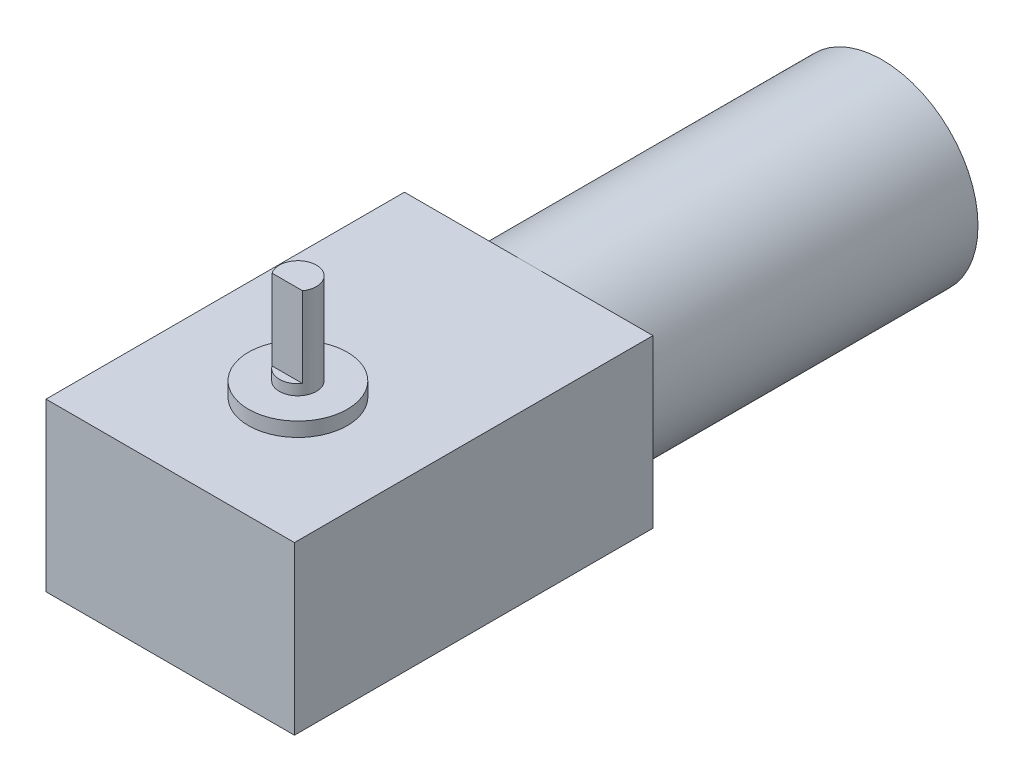
from build123d import *

# Parameters (mm, degrees)
SZKIC1_R                    = 15.5
DODANIE_WYCI_GNI_CIE1_DEPTH = 57.2
SZKIC2_W                    = 40.2
SZKIC2_H                    = 27
DODANIE_WYCI_GNI_CIE2_DEPTH = 58
SZKIC3_R                    = 8
DODANIE_WYCI_GNI_CIE3_DEPTH = 2.3
SZKIC4_R                    = 3
DODANIE_WYCI_GNI_CIE4_DEPTH = 14.7
SZKIC5_W                    = 6.794003974
SZKIC5_H                    = 1.284090098
WYTNIJ_WYCI_GNI_CIE1_DEPTH  = 13
SZKIC6_R                    = 2
WYTNIJ_WYCI_GNI_CIE2_DEPTH  = 7
SZKIC7_R                    = 9.25
DODANIE_WYCI_GNI_CIE5_DEPTH = 4.5
DODANIE_WYCI_GNI_CIE6_START = 2
SZKIC8_R                    = 3.5
SZKIC8_R_2                  = 2
DODANIE_WYCI_GNI_CIE6_DEPTH = 2


with BuildPart() as part:
    # Szkic1 → Dodanie-wyciągnięcie1 (new body)
    with BuildSketch(Plane.XY):
        Circle(SZKIC1_R)
    extrude(amount=DODANIE_WYCI_GNI_CIE1_DEPTH)

    # Szkic2 → Dodanie-wyciągnięcie2 (add)
    with BuildSketch(Plane.XY.offset(57.2)):
        with Locations((0, 2)):
            Rectangle(SZKIC2_W, SZKIC2_H)
    extrude(amount=DODANIE_WYCI_GNI_CIE2_DEPTH)

    # Szkic3 → Dodanie-wyciągnięcie3 (add)
    with BuildSketch(Plane(origin=(0, 15.5, 0), x_dir=(1, 0, 0), z_dir=(0, 1, 0))):
        with Locations(Location((0, -94.540551958, 0), (0, 0, 270))):
            Circle(SZKIC3_R)
    extrude(amount=DODANIE_WYCI_GNI_CIE3_DEPTH)

    # Szkic4 → Dodanie-wyciągnięcie4 (add)
    with BuildSketch(Plane(origin=(0, 17.8, 0), x_dir=(1, 0, 0), z_dir=(0, 1, 0))):
        with Locations(Location((0, -94.540551958, 0), (0, 0, 270))):
            Circle(SZKIC4_R)
    extrude(amount=DODANIE_WYCI_GNI_CIE4_DEPTH)

    # Szkic5 → Wytnij-wyciągnięcie1 (cut)
    with BuildSketch(Plane(origin=(0, 32.5, 0), x_dir=(1, 0, 0), z_dir=(0, 1, 0))):
        with Locations((0.179126758, -96.898506909)):
            Rectangle(SZKIC5_W, SZKIC5_H)
    extrude(amount=-WYTNIJ_WYCI_GNI_CIE1_DEPTH, mode=Mode.SUBTRACT)

    # Szkic6 → Wytnij-wyciągnięcie2 (cut)
    with BuildSketch(Plane.XZ.offset(11.5)):
        with Locations(Location((14.1, 106.2, 0), (0, 0, 270))):
            Circle(SZKIC6_R)
        with Locations(Location((14.1, 66.2, 0), (0, 0, 90))):
            Circle(SZKIC6_R)
        with Locations(Location((-14.1, 66.2, 0), (0, 0, 270))):
            Circle(SZKIC6_R)
        with Locations(Location((-14.1, 106.2, 0), (0, 0, 90))):
            Circle(SZKIC6_R)
    extrude(amount=-WYTNIJ_WYCI_GNI_CIE2_DEPTH, mode=Mode.SUBTRACT)

    # Szkic7 → Dodanie-wyciągnięcie5 (add)
    with BuildSketch(Plane.XZ.offset(11.5)):
        with Locations(Location((0, 95.2, 0), (0, 0, 90))):
            Circle(SZKIC7_R)
    extrude(amount=DODANIE_WYCI_GNI_CIE5_DEPTH)

    # Szkic8 → Dodanie-wyciągnięcie6 (add)
    # profile 1 of 4: a face of its own
    with BuildSketch(Plane.XZ.offset(11.5).offset(DODANIE_WYCI_GNI_CIE6_START)):
        with Locations(Location((14.1, 106.2, 0), (0, 0, 90))):
            Circle(SZKIC8_R)
        with Locations(Location((14.1, 106.2, 0), (0, 0, 270))):
            Circle(SZKIC8_R_2, mode=Mode.SUBTRACT)
    # profile 2 of 4: a face of its own
    with BuildSketch(Plane.XZ.offset(11.5).offset(DODANIE_WYCI_GNI_CIE6_START)):
        with Locations(Location((14.1, 66.2, 0), (0, 0, 90))):
            Circle(SZKIC8_R)
        with Locations(Location((14.1, 66.2, 0), (0, 0, 270))):
            Circle(SZKIC8_R_2, mode=Mode.SUBTRACT)
    # profile 3 of 4: a face of its own
    with BuildSketch(Plane.XZ.offset(11.5).offset(DODANIE_WYCI_GNI_CIE6_START)):
        with Locations(Location((-14.1, 66.2, 0), (0, 0, 90))):
            Circle(SZKIC8_R)
        with Locations(Location((-14.1, 66.2, 0), (0, 0, 270))):
            Circle(SZKIC8_R_2, mode=Mode.SUBTRACT)
    # profile 4 of 4: a face of its own
    with BuildSketch(Plane.XZ.offset(11.5).offset(DODANIE_WYCI_GNI_CIE6_START)):
        with Locations(Location((-14.1, 106.2, 0), (0, 0, 90))):
            Circle(SZKIC8_R)
        with Locations(Location((-14.1, 106.2, 0), (0, 0, 270))):
            Circle(SZKIC8_R_2, mode=Mode.SUBTRACT)
    extrude(amount=-DODANIE_WYCI_GNI_CIE6_DEPTH)


solid = part.part
